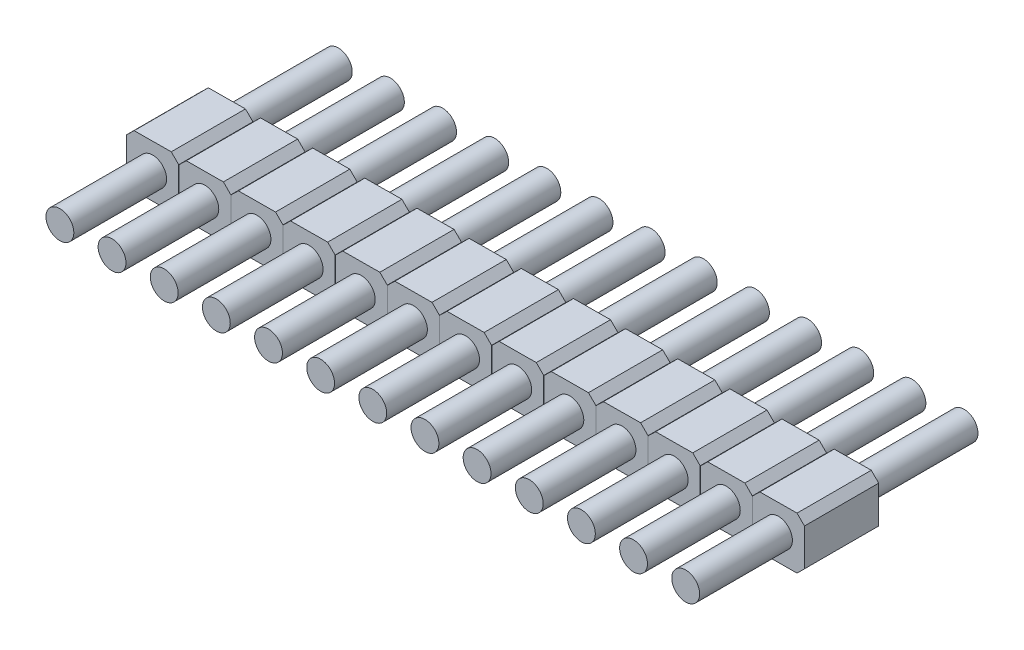
from build123d import *

# Parameters (mm, degrees)
BOSS_EXTRUDE1_DEPTH      = 4
BOSS_EXTRUDE1_2_DEPTH    = 4
BOSS_EXTRUDE1_3_DEPTH    = 4
BOSS_EXTRUDE1_4_DEPTH    = 4
BOSS_EXTRUDE1_5_DEPTH    = 4
BOSS_EXTRUDE1_6_DEPTH    = 4
BOSS_EXTRUDE1_7_DEPTH    = 4
BOSS_EXTRUDE1_8_DEPTH    = 4
BOSS_EXTRUDE1_9_DEPTH    = 4
BOSS_EXTRUDE1_10_DEPTH   = 4
BOSS_EXTRUDE1_11_DEPTH   = 4
BOSS_EXTRUDE1_12_DEPTH   = 4
BOSS_EXTRUDE1_13_DEPTH   = 4
BOSS_EXTRUDE3_DEPTH      = 5
BOSS_EXTRUDE3_DEPTH_BACK = 10
SKETCH3_R                = 0.75


with BuildPart() as part:
    # Sketch1 → Boss-Extrude1 (new body)
    with BuildSketch(Plane.XY):
        Polygon((24.078783359, 3.652607968), (23.678783359, 3.264487045), (23.678783359, 1.264487045), (24.078783359, 0.852607968), (26.078783359, 0.864487045), (26.478783359, 1.264487045), (26.478783359, 3.264487045), (26.078783359, 3.666466891), align=None)
    extrude(amount=BOSS_EXTRUDE1_DEPTH)



with BuildPart() as body_2:
    # Sketch1 → Boss-Extrude1 2 (new body)
    with BuildSketch(Plane.XY):
        Polygon((23.268783359, 3.666466891), (21.268783359, 3.652607968), (20.868783359, 3.264487045), (20.868783359, 1.264487045), (21.268783359, 0.852607968), (23.268783359, 0.864487045), (23.668783359, 1.264487045), (23.668783359, 3.264487045), align=None)
    extrude(amount=BOSS_EXTRUDE1_2_DEPTH)


with BuildPart() as body_3:
    # Sketch1 → Boss-Extrude1 3 (new body)
    with BuildSketch(Plane.XY):
        Polygon((20.458783359, 3.666466891), (18.458783359, 3.652607968), (18.058783359, 3.264487045), (18.058783359, 1.264487045), (18.458783359, 0.852607968), (20.458783359, 0.864487045), (20.858783359, 1.264487045), (20.858783359, 3.264487045), align=None)
    extrude(amount=BOSS_EXTRUDE1_3_DEPTH)


with BuildPart() as body_4:
    # Sketch1 → Boss-Extrude1 4 (new body)
    with BuildSketch(Plane.XY):
        Polygon((17.648783359, 3.666466891), (15.648783359, 3.652607968), (15.248783359, 3.264487045), (15.248783359, 1.264487045), (15.648783359, 0.852607968), (17.648783359, 0.864487045), (18.048783359, 1.264487045), (18.048783359, 3.264487045), align=None)
    extrude(amount=BOSS_EXTRUDE1_4_DEPTH)


with BuildPart() as body_5:
    # Sketch1 → Boss-Extrude1 5 (new body)
    with BuildSketch(Plane.XY):
        Polygon((14.838783359, 3.666466891), (12.838783359, 3.652607968), (12.438783359, 3.264487045), (12.438783359, 1.264487045), (12.838783359, 0.852607968), (14.838783359, 0.864487045), (15.238783359, 1.264487045), (15.238783359, 3.264487045), align=None)
    extrude(amount=BOSS_EXTRUDE1_5_DEPTH)


with BuildPart() as body_6:
    # Sketch1 → Boss-Extrude1 6 (new body)
    with BuildSketch(Plane.XY):
        Polygon((12.028783359, 3.666466891), (10.028783359, 3.652607968), (9.628783359, 3.264487045), (9.628783359, 1.264487045), (10.028783359, 0.852607968), (12.028783359, 0.864487045), (12.428783359, 1.264487045), (12.428783359, 3.264487045), align=None)
    extrude(amount=BOSS_EXTRUDE1_6_DEPTH)


with BuildPart() as body_7:
    # Sketch1 → Boss-Extrude1 7 (new body)
    with BuildSketch(Plane.XY):
        Polygon((9.218783359, 3.666466891), (7.218783359, 3.652607968), (6.818783359, 3.264487045), (6.818783359, 1.264487045), (7.218783359, 0.852607968), (9.218783359, 0.864487045), (9.618783359, 1.264487045), (9.618783359, 3.264487045), align=None)
    extrude(amount=BOSS_EXTRUDE1_7_DEPTH)


with BuildPart() as body_8:
    # Sketch1 → Boss-Extrude1 8 (new body)
    with BuildSketch(Plane.XY):
        Polygon((6.408783359, 3.666466891), (4.408783359, 3.652607968), (4.008783359, 3.264487045), (4.008783359, 1.264487045), (4.408783359, 0.852607968), (6.408783359, 0.864487045), (6.808783359, 1.264487045), (6.808783359, 3.264487045), align=None)
    extrude(amount=BOSS_EXTRUDE1_8_DEPTH)


with BuildPart() as body_9:
    # Sketch1 → Boss-Extrude1 9 (new body)
    with BuildSketch(Plane.XY):
        Polygon((3.598783359, 3.666466891), (1.598783359, 3.652607968), (1.198783359, 3.264487045), (1.198783359, 1.264487045), (1.598783359, 0.852607968), (3.598783359, 0.864487045), (3.998783359, 1.264487045), (3.998783359, 3.264487045), align=None)
    extrude(amount=BOSS_EXTRUDE1_9_DEPTH)


with BuildPart() as body_10:
    # Sketch1 → Boss-Extrude1 10 (new body)
    with BuildSketch(Plane.XY):
        Polygon((0.788783359, 3.666466891), (-1.211216641, 3.652607968), (-1.611216641, 3.264487045), (-1.611216641, 1.264487045), (-1.211216641, 0.852607968), (0.788783359, 0.864487045), (1.188783359, 1.264487045), (1.188783359, 3.264487045), align=None)
    extrude(amount=BOSS_EXTRUDE1_10_DEPTH)


with BuildPart() as body_11:
    # Sketch1 → Boss-Extrude1 11 (new body)
    with BuildSketch(Plane.XY):
        Polygon((-2.021216641, 3.666466891), (-4.021216641, 3.652607968), (-4.421216641, 3.264487045), (-4.421216641, 1.264487045), (-4.021216641, 0.852607968), (-2.021216641, 0.864487045), (-1.621216641, 1.264487045), (-1.621216641, 3.264487045), align=None)
    extrude(amount=BOSS_EXTRUDE1_11_DEPTH)


with BuildPart() as body_12:
    # Sketch1 → Boss-Extrude1 12 (new body)
    with BuildSketch(Plane.XY):
        Polygon((-4.831216641, 3.666466891), (-6.831216641, 3.652607968), (-7.231216641, 3.264487045), (-7.231216641, 1.264487045), (-6.831216641, 0.852607968), (-4.831216641, 0.864487045), (-4.431216641, 1.264487045), (-4.431216641, 3.264487045), align=None)
    extrude(amount=BOSS_EXTRUDE1_12_DEPTH)


with BuildPart() as body_13:
    # Sketch1 → Boss-Extrude1 13 (new body)
    with BuildSketch(Plane.XY):
        Polygon((-7.641216641, 3.666466891), (-9.641216641, 3.652607968), (-10.041216641, 3.264487045), (-10.041216641, 1.264487045), (-9.641216641, 0.852607968), (-7.641216641, 0.864487045), (-7.241216641, 1.264487045), (-7.241216641, 3.264487045), align=None)
    extrude(amount=BOSS_EXTRUDE1_13_DEPTH)


with BuildPart() as part_1:
    add(part.part)

    add(body_2.part)  # Boss-Extrude3 merges body 2

    add(body_3.part)  # Boss-Extrude3 merges body 3

    add(body_4.part)  # Boss-Extrude3 merges body 4

    add(body_5.part)  # Boss-Extrude3 merges body 5

    add(body_6.part)  # Boss-Extrude3 merges body 6

    add(body_7.part)  # Boss-Extrude3 merges body 7

    add(body_8.part)  # Boss-Extrude3 merges body 8

    add(body_9.part)  # Boss-Extrude3 merges body 9

    add(body_10.part)  # Boss-Extrude3 merges body 10

    add(body_11.part)  # Boss-Extrude3 merges body 11

    add(body_12.part)  # Boss-Extrude3 merges body 12

    add(body_13.part)  # Boss-Extrude3 merges body 13
    # Sketch3 → Boss-Extrude3 (add, two sides: drawn at the far end of the back side and taken through both)
    with BuildSketch(Plane.XY.offset(4).offset(-BOSS_EXTRUDE3_DEPTH_BACK)):
        with Locations((-8.641216641, 2.264487045)):
            Circle(SKETCH3_R)
        with Locations((-5.831216641, 2.264487045)):
            Circle(SKETCH3_R)
        with Locations((-3.021216641, 2.264487045)):
            Circle(SKETCH3_R)
        with Locations((-0.211216641, 2.264487045)):
            Circle(SKETCH3_R)
        with Locations((2.598783359, 2.264487045)):
            Circle(SKETCH3_R)
        with Locations((5.408783359, 2.264487045)):
            Circle(SKETCH3_R)
        with Locations((8.218783359, 2.264487045)):
            Circle(SKETCH3_R)
        with Locations((11.028783359, 2.264487045)):
            Circle(SKETCH3_R)
        with Locations((13.838783359, 2.264487045)):
            Circle(SKETCH3_R)
        with Locations((16.648783359, 2.264487045)):
            Circle(SKETCH3_R)
        with Locations((19.458783359, 2.264487045)):
            Circle(SKETCH3_R)
        with Locations((22.268783359, 2.264487045)):
            Circle(SKETCH3_R)
        with Locations((25.078783359, 2.264487045)):
            Circle(SKETCH3_R)
    extrude(amount=BOSS_EXTRUDE3_DEPTH + BOSS_EXTRUDE3_DEPTH_BACK)


solid = part_1.part
